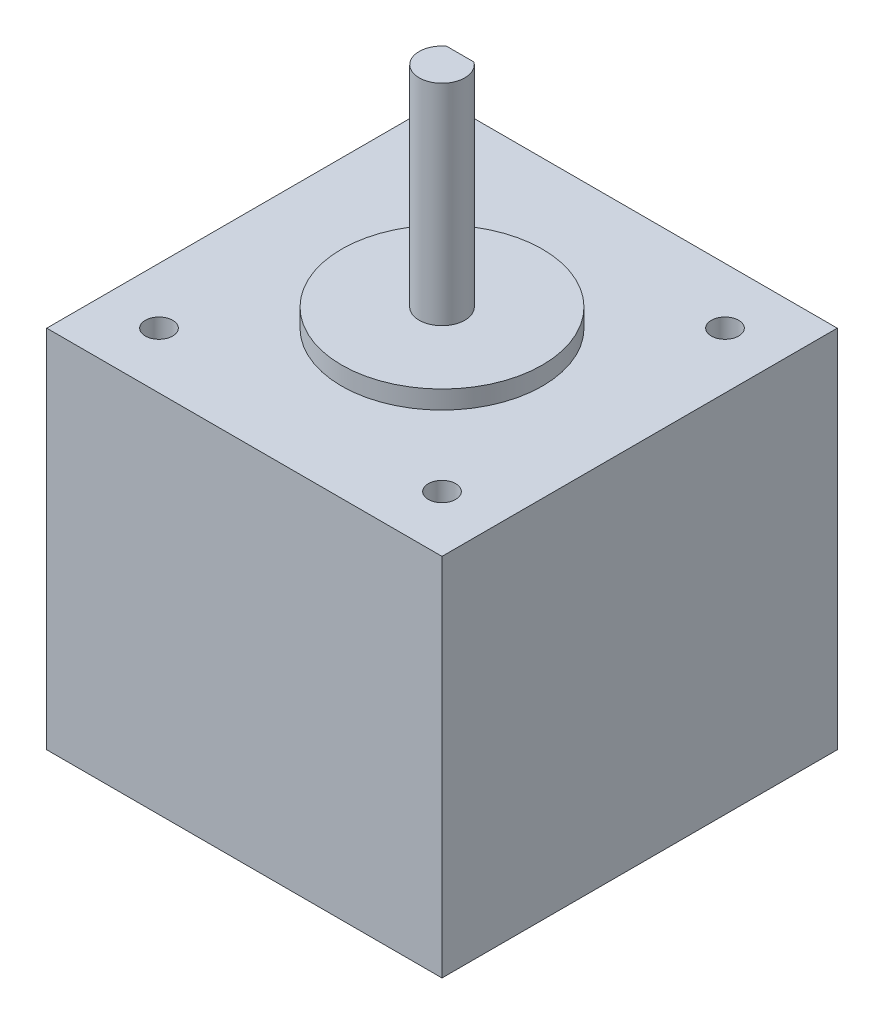
from build123d import *

# Parameters (mm, degrees)
SKETCH1_W               = 43.3
SKETCH1_H               = 43.3
BOSS_EXTRUDE1_DEPTH     = 40
SKETCH2_R               = 11
BOSS_EXTRUDE2_DEPTH     = 2
SKETCH3_R               = 2.5
BOSS_EXTRUDE3_DEPTH     = 25
CUT_EXTRUDE1_DEPTH      = 72.850156576
CUT_EXTRUDE1_DEPTH_BACK = 72.850156576
SKETCH4_W               = 0.5
SKETCH4_H               = 15
SKETCH5_R               = 1.5
CUT_EXTRUDE2_DEPTH      = 4.5


with BuildPart() as part:
    # Sketch1 → Boss-Extrude1 (new body)
    with BuildSketch(Plane(origin=(0, 0, 0), x_dir=(1, 0, 0), z_dir=(0, 1, 0))):
        Rectangle(SKETCH1_W, SKETCH1_H)
    extrude(amount=BOSS_EXTRUDE1_DEPTH)

    # Sketch2 → Boss-Extrude2 (add)
    with BuildSketch(Plane(origin=(0, 40, 0), x_dir=(1, 0, 0), z_dir=(0, 1, 0))):
        with Locations(Location((0, 0, 0), (0, 0, 270))):
            Circle(SKETCH2_R)
    extrude(amount=BOSS_EXTRUDE2_DEPTH)

    # Sketch3 → Boss-Extrude3 (add)
    with BuildSketch(Plane(origin=(0, 40, 0), x_dir=(1, 0, 0), z_dir=(0, 1, 0))):
        with Locations(Location((0, 0, 0), (0, 0, 270))):
            Circle(SKETCH3_R)
    extrude(amount=BOSS_EXTRUDE3_DEPTH)

    # Sketch4 → Cut-Extrude1 (cut, two sides: drawn at the far end of the back side and taken through both)
    with BuildSketch(Plane(origin=(0, 0, 0), x_dir=(0, 0, -1), z_dir=(1, 0, 0)).offset(-CUT_EXTRUDE1_DEPTH_BACK)):
        with Locations((2.25, 57.5)):
            Rectangle(SKETCH4_W, SKETCH4_H)
    extrude(amount=CUT_EXTRUDE1_DEPTH + CUT_EXTRUDE1_DEPTH_BACK, mode=Mode.SUBTRACT)

    # Sketch5 → Cut-Extrude2 (cut)
    with BuildSketch(Plane(origin=(0, 40, 0), x_dir=(1, 0, 0), z_dir=(0, 1, 0))):
        with Locations(Location((15.5, 15.5, 0), (0, 0, 270))):
            Circle(SKETCH5_R)
        with Locations(Location((15.5, -15.5, 0), (0, 0, 270))):
            Circle(SKETCH5_R)
        with Locations(Location((-15.5, -15.5, 0), (0, 0, 270))):
            Circle(SKETCH5_R)
        with Locations(Location((-15.5, 15.5, 0), (0, 0, 270))):
            Circle(SKETCH5_R)
    extrude(amount=-CUT_EXTRUDE2_DEPTH, mode=Mode.SUBTRACT)


solid = part.part
